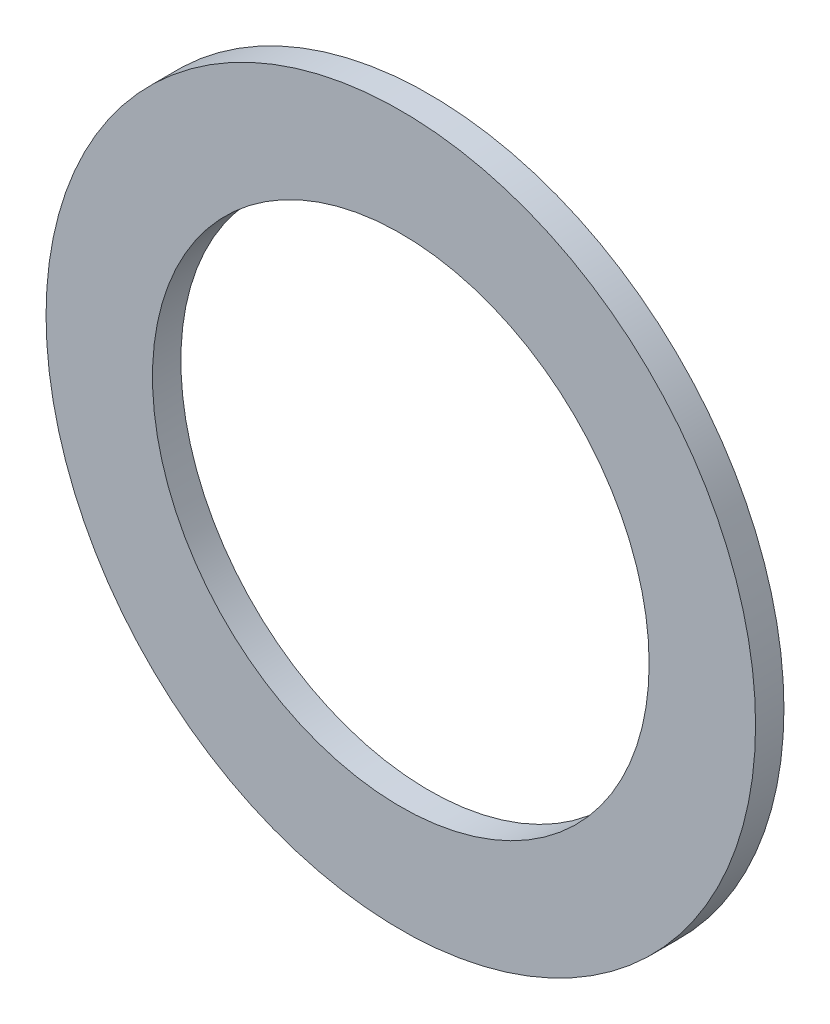
from build123d import *

# Parameters (mm, degrees)
SKETCH_1_R      = 2.5
SKETCH_1_R_2    = 1.75
EXTRUDE_9_DEPTH = 0.2


with BuildPart() as part:
    # Эскиз1 → Бобышка-Вытянуть9 (new body)
    with BuildSketch(Plane.XY):
        Circle(SKETCH_1_R)
        Circle(SKETCH_1_R_2, mode=Mode.SUBTRACT)
    extrude(amount=EXTRUDE_9_DEPTH)


solid = part.part
